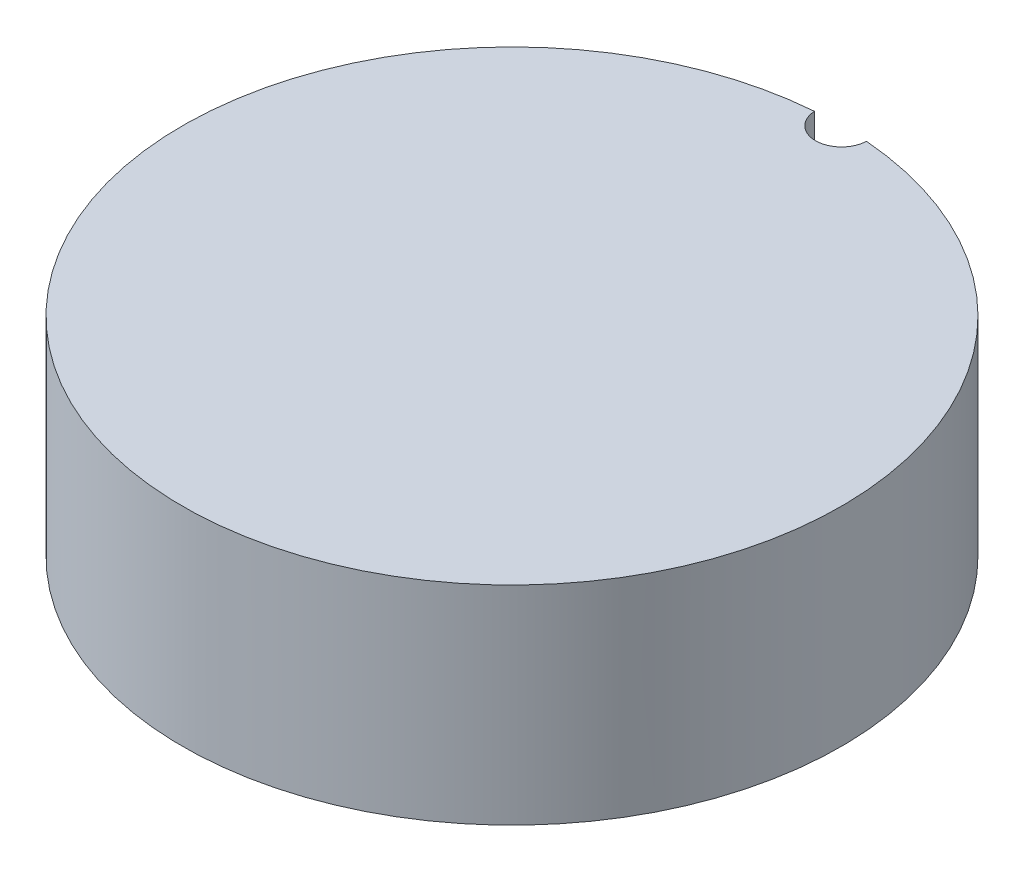
from build123d import *

# Parameters (mm, degrees)
SECOND_STAGE_IGNITION_WIRE_PASSTHROUGH_DEPTH      = 50.070138068
SECOND_STAGE_IGNITION_WIRE_PASSTHROUGH_DEPTH_BACK = 50.070138068


with BuildPart() as part:
    # Sketch1 → Main body (revolve)
    with BuildSketch(Plane.XY):
        with BuildLine():
            Line((0, 0), (0, -10))
            Line((0, -10), (-21.685, -10))
            ThreePointArc((-21.685, -10), (-28.756067812, -12.928932188), (-31.685, -20))
            Line((-31.685, -20), (-31.685, 0))
            Line((-31.685, 0), (0, 0))
        make_face()
    revolve(axis=Axis((0, 0, 0), (0, -1, 0)))

    # Sketch2 → Second stage ignition wire passthrough (cut, two sides: drawn at the far end of the back side and taken through both)
    with BuildSketch(Plane(origin=(0, 0, 0), x_dir=(1, 0, 0), z_dir=(0, 1, 0)).offset(-SECOND_STAGE_IGNITION_WIRE_PASSTHROUGH_DEPTH_BACK)):
        with BuildLine():
            ThreePointArc((-2.498053781, 31.586372889), (0, 29.185), (2.498053781, 31.586372889))
            ThreePointArc((2.498053781, 31.586372889), (0, 31.685), (-2.498053781, 31.586372889))
        make_face()
    extrude(amount=SECOND_STAGE_IGNITION_WIRE_PASSTHROUGH_DEPTH + SECOND_STAGE_IGNITION_WIRE_PASSTHROUGH_DEPTH_BACK, mode=Mode.SUBTRACT)


solid = part.part
